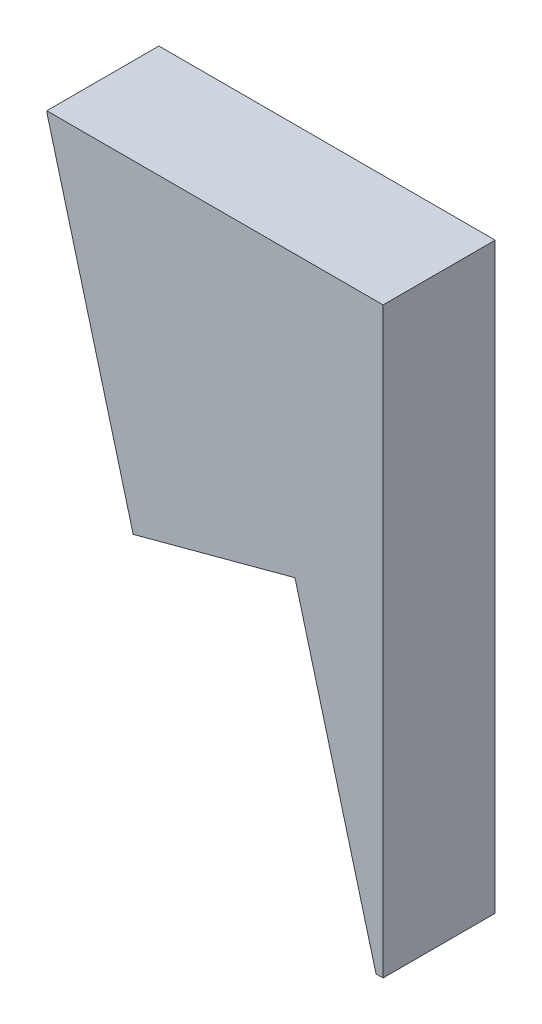
from build123d import *

# Parameters (mm, degrees)
BOSS_EXTRU_1_DEPTH = 10


with BuildPart() as part:
    # Model → Boss.-Extru.1 (new body)
    with BuildSketch(Plane.XY):
        Polygon((401.03807516, -135.93039288), (415.466694883, -132.064242129), (422.698940776, -159.055337947), (423.331977072, -159.055337947), (423.331977072, -107.055346596), (393.331999447, -107.055346596), (393.331999447, -107.170908018), align=None)
    extrude(amount=BOSS_EXTRU_1_DEPTH)


solid = part.part
